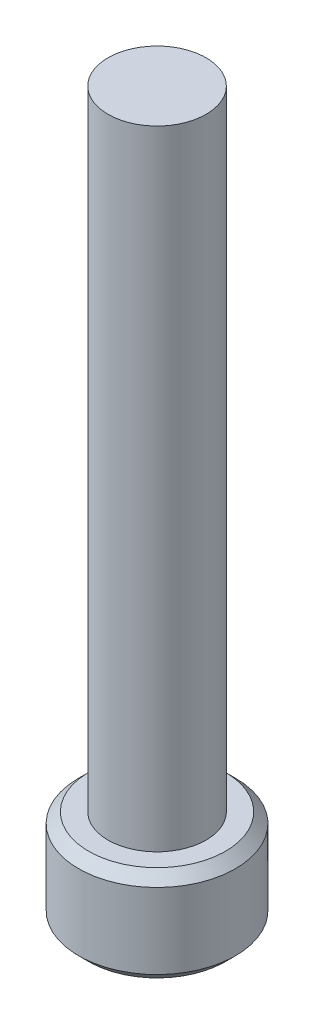
from build123d import *

# Parameters (mm, degrees)
SKETCH1_R           = 2.4765
BOSS_EXTRUDE1_DEPTH = 31.75
SKETCH2_R           = 3.9624
BOSS_EXTRUDE2_DEPTH = 4.826
CUT_EXTRUDE1_DEPTH  = 2.286
CHAMFER1_SIZE       = 0.508


with BuildPart() as part:
    # Sketch1 → Boss-Extrude1 (new body)
    with BuildSketch(Plane(origin=(0, 0, 0), x_dir=(1, 0, 0), z_dir=(0, 1, 0))):
        with Locations(Location((0, 0, 0), (0, 0, 270))):
            Circle(SKETCH1_R)
    extrude(amount=BOSS_EXTRUDE1_DEPTH)

    # Sketch2 → Boss-Extrude2 (add)
    with BuildSketch(Plane.XZ):
        with Locations(Location((0, 0, 0), (0, 0, 270))):
            Circle(SKETCH2_R)
    extrude(amount=BOSS_EXTRUDE2_DEPTH)

    # Sketch3 → Cut-Extrude1 (cut)
    with BuildSketch(Plane.XZ.offset(4.826)):
        Polygon((2.291358881, 0), (1.14567944, 1.984375), (-1.14567944, 1.984375), (-2.291358881, 0), (-1.14567944, -1.984375), (1.14567944, -1.984375), align=None)
    extrude(amount=-CUT_EXTRUDE1_DEPTH, mode=Mode.SUBTRACT)

    # Chamfer1
    chamfer1_edges = [part.edges().sort_by_distance(p)[0] for p in [
        (0, 0, 3.9624),
        (0, -4.826, 3.9624),
    ]]
    chamfer(chamfer1_edges, length=CHAMFER1_SIZE)


solid = part.part
